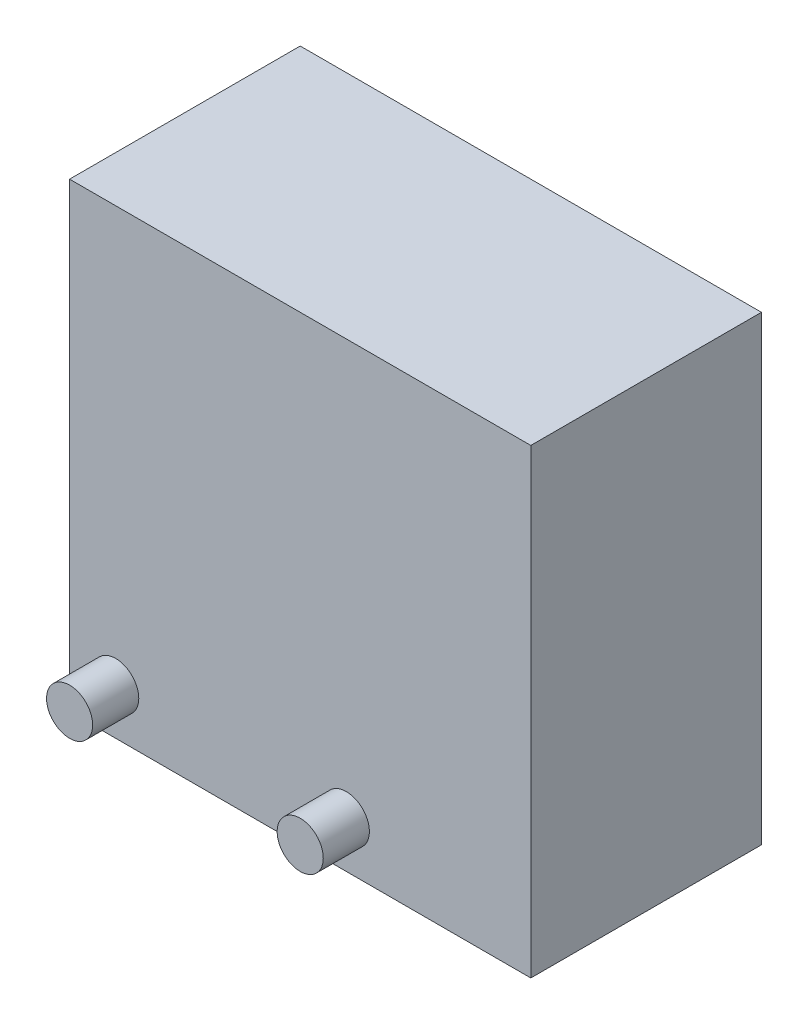
from build123d import *

# Parameters (mm, degrees)
SKETCH_1_W               = 20
SKETCH_1_H               = 20
BASEBOX_DEPTH            = 10
SKETCH_2_R               = 1
BOSSSEED_DEPTH           = 2
LINEARPATTERN_COUNT      = 2
LINEARPATTERN_PITCH      = 10
LINEARPATTERN_COUNT_DIR2 = 3
LINEARPATTERN_PITCH_DIR2 = 15


with BuildPart() as part:
    # 草图1 → BaseBox (new body)
    with BuildSketch(Plane.XY):
        with Locations((10, 10)):
            Rectangle(SKETCH_1_W, SKETCH_1_H)
    extrude(amount=BASEBOX_DEPTH)

    # 草图2 → BossSeed (add)
    with BuildSketch(Plane.XY.offset(10)):
        with Locations((2, 2)):
            Circle(SKETCH_2_R)
    bossseed = extrude(amount=BOSSSEED_DEPTH)

    # LinearPattern: BossSeed 2 × 3, 4 skipped
    with Locations(*[(i * LINEARPATTERN_PITCH, -j * LINEARPATTERN_PITCH_DIR2, 0) for i in range(LINEARPATTERN_COUNT) for j in range(LINEARPATTERN_COUNT_DIR2) if (i, j) not in ((0, 0), (0, 1), (0, 2), (1, 1), (1, 2))]):
        add(bossseed)


solid = part.part
